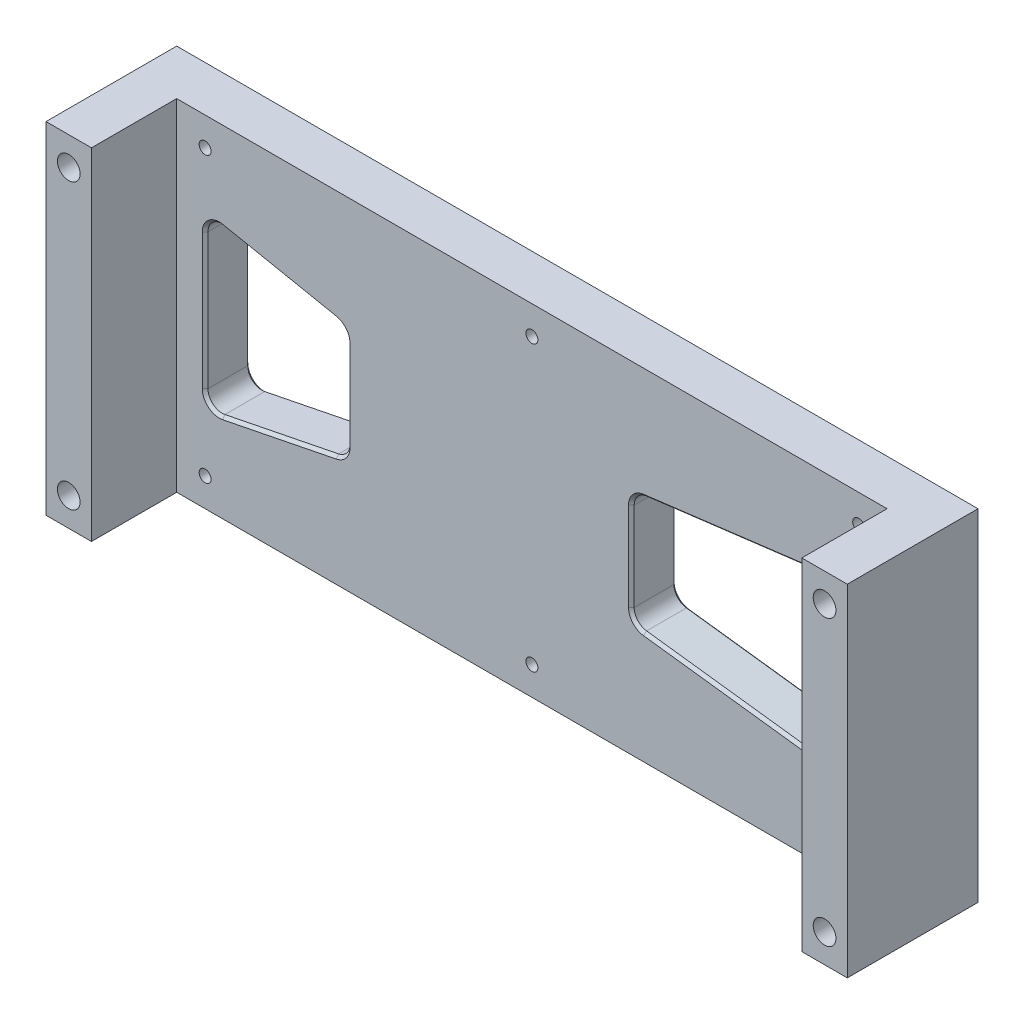
from build123d import *

# Parameters (mm, degrees)
SKETCH1_W                   = 282
SKETCH1_H                   = 16
BOSS_EXTRUDE1_DEPTH         = 120
SKETCH4_W                   = 16
SKETCH4_H                   = 120
BOSS_EXTRUDE2_DEPTH         = 30
SKETCH2_R                   = 4
CUT_EXTRUDE1_DEPTH          = 278.546392518
M5_TAPPED_HOLE1_D           = 4.2
TAP_DRILL_FOR_M6_TAP1_D     = 5
TAP_DRILL_FOR_M6_TAP1_DEPTH = 8
TAP_DRILL_FOR_M6_TAP1_TIP   = 1.502151548
CUT_EXTRUDE2_DEPTH          = 278.546392518
CHAMFER1_SIZE               = 1


with BuildPart() as part:
    # Sketch1 → Boss-Extrude1 (new body)
    with BuildSketch(Plane(origin=(0, 0, 0), x_dir=(1, 0, 0), z_dir=(0, 1, 0))):
        with Locations((105, 38)):
            Rectangle(SKETCH1_W, SKETCH1_H)
    extrude(amount=BOSS_EXTRUDE1_DEPTH)

    # Sketch4 → Boss-Extrude2 (add)
    with BuildSketch(Plane.XY.offset(-30)):
        with Locations((-28, 60)):
            Rectangle(SKETCH4_W, SKETCH4_H)
        with Locations((238, 60)):
            Rectangle(SKETCH4_W, SKETCH4_H)
    extrude(amount=BOSS_EXTRUDE2_DEPTH)

    # Sketch2 → Cut-Extrude1 (cut, through all)
    with BuildSketch(Plane.XY.offset(-46)):
        with Locations(Location((238, 110, 0), (0, 0, 180))):
            Circle(SKETCH2_R)
        with Locations(Location((-28, 110, 0), (0, 0, 180))):
            Circle(SKETCH2_R)
        with Locations(Location((-28, 10, 0), (0, 0, 180))):
            Circle(SKETCH2_R)
        with Locations(Location((238, 10, 0), (0, 0, 180))):
            Circle(SKETCH2_R)
    extrude(amount=CUT_EXTRUDE1_DEPTH, mode=Mode.SUBTRACT)

    # M5 Tapped Hole1 (through all)
    with Locations(Plane.XY.offset(-30)):
        with Locations((-10, 110), (105, 110), (220, 110), (220, 10), (105, 10), (-10, 10)):
            Hole(M5_TAPPED_HOLE1_D / 2)

    # Tap Drill for M6 Tap1
    with Locations(Plane(origin=(0, 0, -46), x_dir=(-1, 0, 0), z_dir=(0, 0, -1))):
        with Locations((-55, 51), (-55, 69), (-125, 69), (-125, 51)):
            Hole(TAP_DRILL_FOR_M6_TAP1_D / 2, depth=TAP_DRILL_FOR_M6_TAP1_DEPTH)
            with Locations((0, 0, -(TAP_DRILL_FOR_M6_TAP1_DEPTH + TAP_DRILL_FOR_M6_TAP1_TIP / 2))):  # 118° drill point
                Cone(0, TAP_DRILL_FOR_M6_TAP1_D / 2, TAP_DRILL_FOR_M6_TAP1_TIP, mode=Mode.SUBTRACT)

    # Sketch11 → Cut-Extrude2 (cut, through all)
    with BuildSketch(Plane(origin=(0, 0, -46), x_dir=(-1, 0, 0), z_dir=(0, 0, -1))):
        with BuildLine():
            Line((-140, 75.586088907), (-140, 44.413911093))
            ThreePointArc((-140, 44.413911093), (-141.251609121, 41.104898277), (-144.379826327, 39.452521709))
            Line((-144.379826327, 39.452521709), (-214.379826327, 30.702521709))
            ThreePointArc((-214.379826327, 30.702521709), (-218.309012816, 31.915520214), (-220, 35.663911093))
            Line((-220, 35.663911093), (-220, 84.336088907))
            ThreePointArc((-220, 84.336088907), (-218.309012816, 88.084479786), (-214.379826327, 89.297478291))
            Line((-214.379826327, 89.297478291), (-144.379826327, 80.547478291))
            ThreePointArc((-144.379826327, 80.547478291), (-141.251609121, 78.895101723), (-140, 75.586088907))
        make_face()
        with BuildLine():
            Line((10, 83.900980486), (10, 36.099019514))
            ThreePointArc((10, 36.099019514), (8.169944528, 32.232308807), (4.019419324, 31.196116135))
            Line((4.019419324, 31.196116135), (-35.980580676, 39.196116135))
            ThreePointArc((-35.980580676, 39.196116135), (-38.866710707, 40.929074986), (-40, 44.099019514))
            Line((-40, 44.099019514), (-40, 75.900980486))
            ThreePointArc((-40, 75.900980486), (-38.866710707, 79.070925014), (-35.980580676, 80.803883865))
            Line((-35.980580676, 80.803883865), (4.019419324, 88.803883865))
            ThreePointArc((4.019419324, 88.803883865), (8.169944528, 87.767691193), (10, 83.900980486))
        make_face()
    extrude(amount=-CUT_EXTRUDE2_DEPTH, mode=Mode.SUBTRACT)

    # Chamfer1
    chamfer1_edges = [part.edges().sort_by_distance(p)[0] for p in [
        (141.251609121, 41.104898277, -30),
        (179.379826327, 35.077521709, -30),
        (218.309012816, 31.915520214, -30),
        (220, 60, -30),
        (218.309012816, 88.084479786, -30),
        (179.379826327, 84.922478291, -30),
        (141.251609121, 78.895101723, -30),
        (140, 60, -30),
        (141.251609121, 41.104898277, -46),
        (140, 60, -46),
        (141.251609121, 78.895101723, -46),
        (179.379826327, 84.922478291, -46),
        (218.309012816, 88.084479786, -46),
        (220, 60, -46),
        (218.309012816, 31.915520214, -46),
        (179.379826327, 35.077521709, -46),
        (-8.169944528, 32.232308807, -30),
        (15.980580676, 35.196116135, -30),
        (38.866710707, 40.929074986, -30),
        (40, 60, -30),
        (38.866710707, 79.070925014, -30),
        (15.980580676, 84.803883865, -30),
        (-8.169944528, 87.767691193, -30),
        (-10, 60, -30),
        (-8.169944528, 32.232308807, -46),
        (-10, 60, -46),
        (-8.169944528, 87.767691193, -46),
        (15.980580676, 84.803883865, -46),
        (38.866710707, 79.070925014, -46),
        (40, 60, -46),
        (38.866710707, 40.929074986, -46),
        (15.980580676, 35.196116135, -46),
    ]]
    chamfer(chamfer1_edges, length=CHAMFER1_SIZE)


solid = part.part
